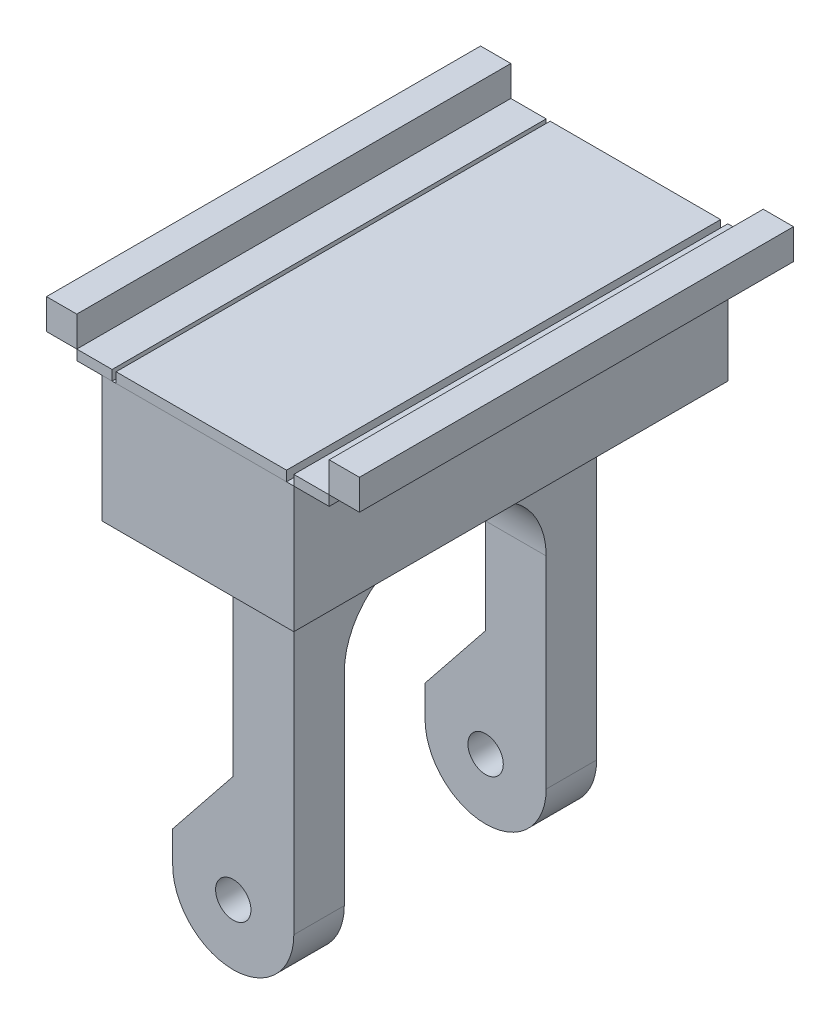
from build123d import *

# Parameters (mm, degrees)
ESQUISSE1_R             = 3.5
BOSS_EXTRU_1_DEPTH      = 10
BOSS_EXTRU_2_DEPTH      = 5
ESQUISSE3_W             = 12
ESQUISSE3_H             = 40
BOSS_EXTRU_3_DEPTH      = 5
CONG_1_R                = 15
ESQUISSE4_W             = 38
ESQUISSE4_H             = 86
BOSS_EXTRU_4_DEPTH      = 25
ESQUISSE5_W             = 28
ESQUISSE5_H             = 76
ENL_V_MAT_EXTRU_1_DEPTH = 25
ESQUISSE7_W             = 7
ESQUISSE7_H             = 86
BOSS_EXTRU_6_DEPTH      = 2
ESQUISSE8_W             = 6
ESQUISSE8_H             = 86
BOSS_EXTRU_7_DEPTH      = 6
ESQUISSE11_W            = 33.762776186
ESQUISSE11_H            = 85.999999968
BOSS_EXTRU_10_DEPTH     = 2


with BuildPart() as part:
    # Esquisse1 → Boss.-Extru.1 (new body)
    with BuildSketch(Plane.XY):
        with BuildLine():
            Line((-12, 0), (-12, 6.188999999))
            Line((-12, 6.188999999), (0, 21.189735812))
            Line((0, 21.189735812), (0, 60))
            Line((0, 60), (12, 60))
            Line((12, 60), (12, 0))
            ThreePointArc((12, 0), (0, -12), (-12, 0))
        make_face()
        Circle(ESQUISSE1_R, mode=Mode.SUBTRACT)
    extrude(amount=BOSS_EXTRU_1_DEPTH)


with BuildPart() as body_2:
    # Esquisse2 → Boss.-Extru.2 (new body)
    with BuildSketch(Plane(origin=(0, 60, 0), x_dir=(1, 0, 0), z_dir=(0, 1, 0))):
        Polygon((0, -10), (0, -60), (12, -60), (12, -10), (12, 0), (0, 0), align=None)
    extrude(amount=BOSS_EXTRU_2_DEPTH)


with BuildPart() as body_3:
    # Symétrie2: mirrored copy
    add(part.part.mirror(Plane.XY.offset(30)))

    # Combiner1: union body 2, part
    add(body_2.part)
    add(part.part)

    # Esquisse3 → Boss.-Extru.3 (add)
    with BuildSketch(Plane.XZ.offset(-60)):
        with Locations((6, 30)):
            Rectangle(ESQUISSE3_W, ESQUISSE3_H)
    extrude(amount=BOSS_EXTRU_3_DEPTH)

    # Congé1
    cong_1_edges = [body_3.edges().sort_by_distance(p)[0] for p in [
        (6, 55, 10),
        (6, 55, 50),
    ]]
    fillet(cong_1_edges, radius=CONG_1_R)

    # Esquisse4 → Boss.-Extru.4 (add)
    with BuildSketch(Plane(origin=(0, 65, 0), x_dir=(1, 0, 0), z_dir=(0, 1, 0))):
        with Locations((6, -30)):
            Rectangle(ESQUISSE4_W, ESQUISSE4_H)
    extrude(amount=BOSS_EXTRU_4_DEPTH)

    # Esquisse5 → Enlèv. mat.-Extru.1 (cut)
    with BuildSketch(Plane(origin=(0, 90, 0), x_dir=(1, 0, 0), z_dir=(0, 1, 0))):
        with Locations((6, -30)):
            Rectangle(ESQUISSE5_W, ESQUISSE5_H)
    extrude(amount=-ENL_V_MAT_EXTRU_1_DEPTH, mode=Mode.SUBTRACT)


with BuildPart() as enl_v_mat_extru_1_piece_1:
    # of the separate pieces the step leaves, piece 1, a body of its own (enl_v_mat_extru_1_pieces)
    add(body_3.part.solids().sort_by_distance((12, 65, 0))[0])


with BuildPart() as enl_v_mat_extru_1_piece_2:
    # of the separate pieces the step leaves, piece 2, a body of its own (enl_v_mat_extru_1_pieces)
    add(body_3.part.solids().sort_by_distance((25, 65, 73))[0])


with BuildPart() as body_3_2:
    # Esquisse7 → Boss.-Extru.6 (new body)
    with BuildSketch(Plane(origin=(0, 90, 0), x_dir=(1, 0, 0), z_dir=(0, 1, 0))):
        with Locations((28.5, -30)):
            Rectangle(ESQUISSE7_W, ESQUISSE7_H)
    extrude(amount=BOSS_EXTRU_6_DEPTH)


with BuildPart() as body_4:
    # Esquisse8 → Boss.-Extru.7 (new body)
    with BuildSketch(Plane(origin=(0, 92, 0), x_dir=(1, 0, 0), z_dir=(0, 1, 0))):
        with Locations((35, -30)):
            Rectangle(ESQUISSE8_W, ESQUISSE8_H)
    extrude(amount=BOSS_EXTRU_7_DEPTH)


with BuildPart() as body_5:
    # Symétrie4: mirrored copy
    add(body_3_2.part.mirror(Plane.ZY.offset(-7)))


with BuildPart() as body_6:
    # Sym_trie4 2: mirrored copy
    add(body_4.part.mirror(Plane.ZY.offset(-7)))


with BuildPart() as body_7:
    # Esquisse11 → Boss.-Extru.10 (new body)
    with BuildSketch(Plane(origin=(0, 90, 0), x_dir=(1, 0, 0), z_dir=(0, 1, 0))):
        with Locations((6.67114179, -30)):
            Rectangle(ESQUISSE11_W, ESQUISSE11_H)
    extrude(amount=BOSS_EXTRU_10_DEPTH)


solid = Compound([enl_v_mat_extru_1_piece_1.part, enl_v_mat_extru_1_piece_2.part, body_3_2.part, body_4.part, body_5.part, body_6.part, body_7.part])
